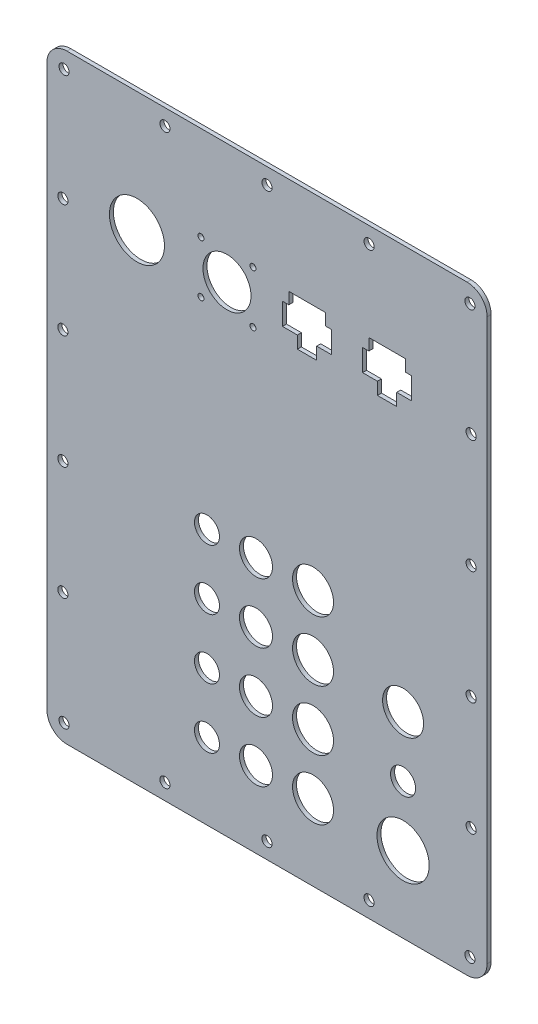
from build123d import *

# Parameters (mm, degrees)
BOSS_EXTRUDE1_DEPTH = 2
SKETCH2_R           = 2.525
CUT_EXTRUDE1_DEPTH  = 187.021504133
SKETCH3_R           = 10.25
SKETCH3_R_2         = 8.25
SKETCH3_R_3         = 6.25
CUT_EXTRUDE2_DEPTH  = 187.021504133
CUT_EXTRUDE3_DEPTH  = 187.021504133
SKETCH6_R           = 12
SKETCH6_R_2         = 1.5
CUT_EXTRUDE4_DEPTH  = 187.021504133
CUT_EXTRUDE5_REACH  = 188.022
SKETCH7_R           = 13.75
CUT_EXTRUDE6_REACH  = 188.022
SKETCH8_R           = 13.05
SKETCH9_R           = 10.25
SKETCH9_R_2         = 6.25
CUT_EXTRUDE7_DEPTH  = 2


with BuildPart() as part:
    # Sketch1 → Boss-Extrude1 (new body)
    with BuildSketch(Plane.XY):
        with BuildLine():
            Line((-100, -150), (100, -150))
            ThreePointArc((100, -150), (107.071067812, -147.071067812), (110, -140))
            Line((110, -140), (110, 140))
            ThreePointArc((110, 140), (107.071067812, 147.071067812), (100, 150))
            Line((100, 150), (-100, 150))
            ThreePointArc((-100, 150), (-107.071067812, 147.071067812), (-110, 140))
            Line((-110, 140), (-110, -140))
            ThreePointArc((-110, -140), (-107.071067812, -147.071067812), (-100, -150))
        make_face()
    extrude(amount=BOSS_EXTRUDE1_DEPTH)

    # Sketch2 → Cut-Extrude1 (cut, through all)
    with BuildSketch(Plane.XY.offset(2)):
        with Locations((-101.414213562, 141.414213562)):
            Circle(SKETCH2_R)
        with Locations(Location((101.414213562, 141.414213562, 0), (0, 0, 180))):
            Circle(SKETCH2_R)
        with Locations((-51, 142)):
            Circle(SKETCH2_R)
        with Locations(Location((51, 142, 0), (0, 0, 180))):
            Circle(SKETCH2_R)
        with Locations((-102, 85.2)):
            Circle(SKETCH2_R)
        with Locations((-102, 28.4)):
            Circle(SKETCH2_R)
        with Locations(Location((102, 28.4, 0), (0, 0, 180))):
            Circle(SKETCH2_R)
        with Locations(Location((102, 85.2, 0), (0, 0, 180))):
            Circle(SKETCH2_R)
        with Locations((102, -28.4)):
            Circle(SKETCH2_R)
        with Locations((102, -85.2)):
            Circle(SKETCH2_R)
        with Locations((101.414213562, -141.414213562)):
            Circle(SKETCH2_R)
        with Locations((51, -142)):
            Circle(SKETCH2_R)
        with Locations(Location((-51, -142, 0), (0, 0, 180))):
            Circle(SKETCH2_R)
        with Locations(Location((-101.414213562, -141.414213562, 0), (0, 0, 180))):
            Circle(SKETCH2_R)
        with Locations(Location((-102, -85.2, 0), (0, 0, 180))):
            Circle(SKETCH2_R)
        with Locations(Location((-102, -28.4, 0), (0, 0, 180))):
            Circle(SKETCH2_R)
        with Locations((0, 142)):
            Circle(SKETCH2_R)
        with Locations(Location((0, -142, 0), (0, 0, 180))):
            Circle(SKETCH2_R)
    extrude(amount=-CUT_EXTRUDE1_DEPTH, mode=Mode.SUBTRACT)

    # Sketch3 → Cut-Extrude2 (cut, through all)
    with BuildSketch(Plane.XY.offset(2)):
        with Locations((23, -112)):
            Circle(SKETCH3_R)
        with Locations((-5.5, -112)):
            Circle(SKETCH3_R_2)
        with Locations((23, -82)):
            Circle(SKETCH3_R)
        with Locations((-5.5, -82)):
            Circle(SKETCH3_R_2)
        with Locations((23, -52)):
            Circle(SKETCH3_R)
        with Locations((-5.5, -52)):
            Circle(SKETCH3_R_2)
        with Locations((23, -22)):
            Circle(SKETCH3_R)
        with Locations((-5.5, -22)):
            Circle(SKETCH3_R_2)
        with Locations((-30, -112)):
            Circle(SKETCH3_R_3)
        with Locations((-30, -82)):
            Circle(SKETCH3_R_3)
        with Locations((-30, -52)):
            Circle(SKETCH3_R_3)
        with Locations((-30, -22)):
            Circle(SKETCH3_R_3)
    extrude(amount=-CUT_EXTRUDE2_DEPTH, mode=Mode.SUBTRACT)

    # Sketch5 → Cut-Extrude3 (cut, through all)
    with BuildSketch(Plane.XY.offset(2)):
        Polygon((10.875, 101.45), (10.875, 95.6), (7.75, 95.6), (7.75, 84.7), (15.175, 84.7), (15.175, 78.55), (24.825, 78.55), (24.825, 84.7), (32.25, 84.7), (32.25, 95.6), (29.125, 95.6), (29.125, 101.45), align=None)
        Polygon((50.875, 101.45), (50.875, 95.6), (47.75, 95.6), (47.75, 84.7), (55.175, 84.7), (55.175, 78.55), (64.825, 78.55), (64.825, 84.7), (72.25, 84.7), (72.25, 95.6), (69.125, 95.6), (69.125, 101.45), align=None)
    extrude(amount=-CUT_EXTRUDE3_DEPTH, mode=Mode.SUBTRACT)

    # Sketch6 → Cut-Extrude4 (cut, through all)
    with BuildSketch(Plane.XY.offset(2)):
        with Locations((-20, 90)):
            Circle(SKETCH6_R)
        with Locations((-7, 103)):
            Circle(SKETCH6_R_2)
        with Locations(Location((-33, 103, 0), (0, 0, 180))):
            Circle(SKETCH6_R_2)
        with Locations(Location((-7, 77, 0), (0, 0, 180))):
            Circle(SKETCH6_R_2)
        with Locations((-33, 77)):
            Circle(SKETCH6_R_2)
    extrude(amount=-CUT_EXTRUDE4_DEPTH, mode=Mode.SUBTRACT)

    # Sketch7 → Cut-Extrude5 (cut, up to next)
    with BuildSketch(Plane.XY.offset(2), mode=Mode.PRIVATE) as cut_extrude5_sk1:
        with Locations((-65, 90)):
            Circle(SKETCH7_R)
    cut_extrude5_tool1 = extrude(cut_extrude5_sk1.sketch, amount=-CUT_EXTRUDE5_REACH, mode=Mode.PRIVATE) & part.part
    add(cut_extrude5_tool1.solids().sort_by_distance((-65, 90, 2))[0], mode=Mode.SUBTRACT)

    # Sketch8 → Cut-Extrude6 (cut, up to next)
    with BuildSketch(Plane.XY.offset(2), mode=Mode.PRIVATE) as cut_extrude6_sk1:
        with Locations((68, -112)):
            Circle(SKETCH8_R)
    cut_extrude6_tool1 = extrude(cut_extrude6_sk1.sketch, amount=-CUT_EXTRUDE6_REACH, mode=Mode.PRIVATE) & part.part
    add(cut_extrude6_tool1.solids().sort_by_distance((68, -112, 2))[0], mode=Mode.SUBTRACT)

    # Sketch9 → Cut-Extrude7 (cut)
    with BuildSketch(Plane.XY.offset(2)):
        with Locations((68, -52)):
            Circle(SKETCH9_R)
        with Locations((68, -82)):
            Circle(SKETCH9_R_2)
    extrude(amount=-CUT_EXTRUDE7_DEPTH, mode=Mode.SUBTRACT)


solid = part.part
